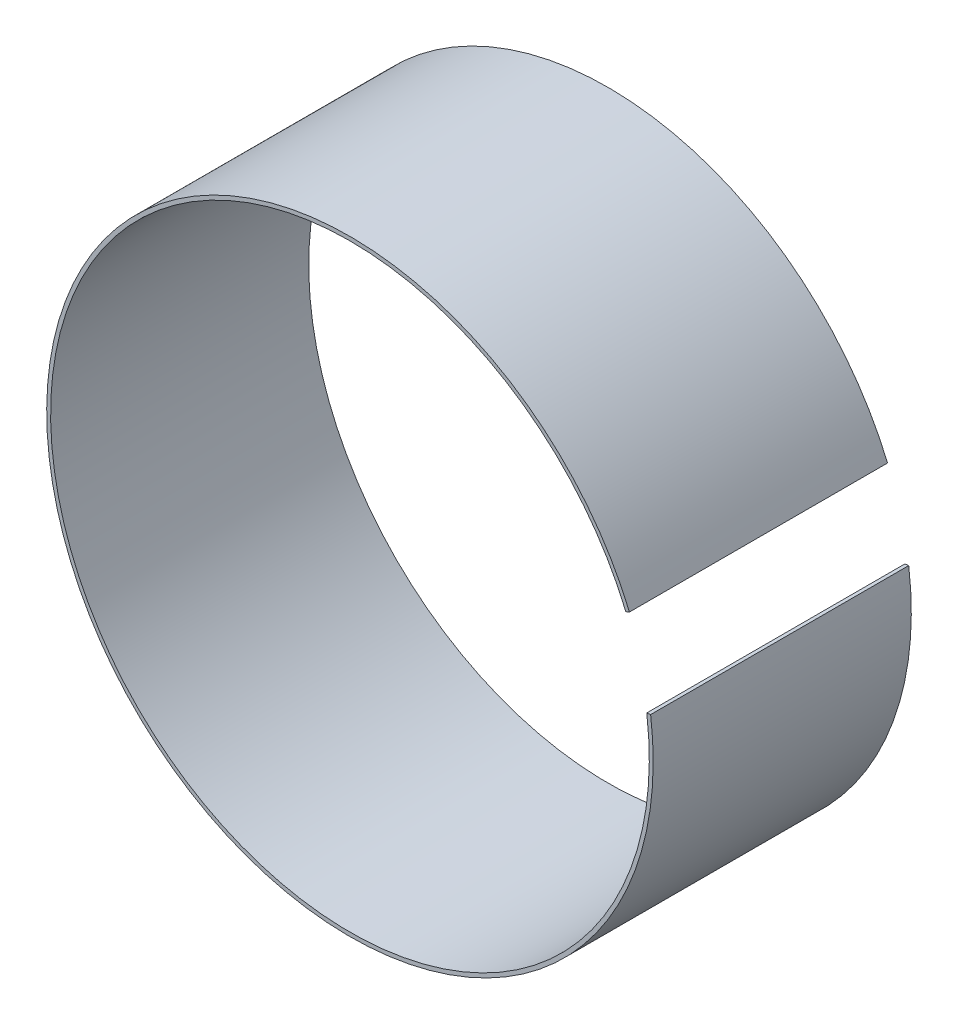
from build123d import *

# Parameters (mm, degrees)
EXTRUDE_THIN5_DEPTH = 33


with BuildPart() as part:
    # Sketch3 → Extrude-Thin5 (new body)
    with BuildSketch(Plane.XY):
        with BuildLine():
            ThreePointArc((38.4439761, 5.045118373), (-37.425743623, -10.129801586), (35.736514213, 15.045118373))
            Line((35.736514213, 15.045118373), (35.27567388, 14.851143665))
            ThreePointArc((35.27567388, 14.851143665), (-36.943119827, -9.999133032), (37.948221683, 4.980098697))
            Line((37.948221683, 4.980098697), (38.4439761, 5.045118373))
        make_face()
    extrude(amount=EXTRUDE_THIN5_DEPTH)


solid = part.part
